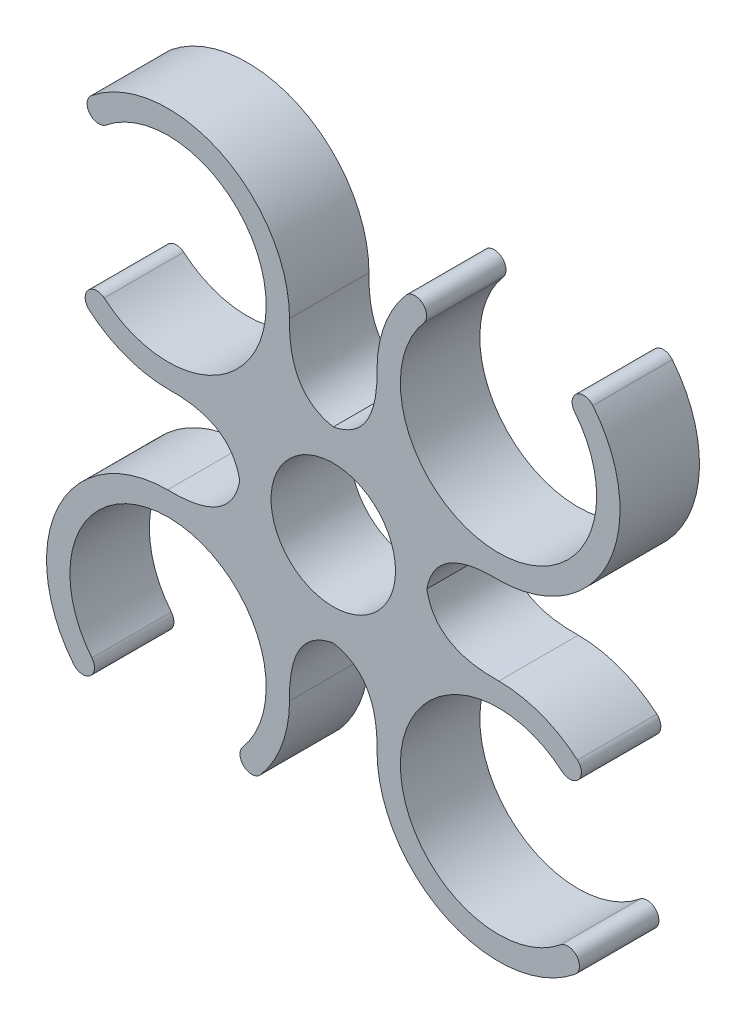
from build123d import *

# Parameters (mm, degrees)
ESQUISSE2_R        = 13.315895319
BOSS_EXTRU_1_DEPTH = 17


with BuildPart() as part:
    # Esquisse2 → Boss.-Extru.1 (new body)
    with BuildSketch(Plane.XY):
        with BuildLine():
            ThreePointArc((-41.970273906, 58.288916899), (-45.477336755, 58.674660716), (-45.106104784, 62.183289358))
            ThreePointArc((-45.106104784, 62.183289358), (-17.574909645, 65.492333679), (-2.716007813, 42.080167687))
            add(Edge.make_bspline(
                [(-2.716007813, 42.080167687), (-3.035124512, 28.491732954), (6.642053999, 26.657753906)],
                knots=[0, 0, 0, 1, 1, 1], degree=2))
            add(Edge.make_bspline(
                [(16, 42.080237959), (16.319218738, 28.491805623), (6.642053999, 26.657753906)],
                knots=[0, 0, 0, 1, 1, 1], degree=2))
            ThreePointArc((16, 42.080237959), (17.620066034, 51.034561919), (22.226418394, 58.882239885))
            ThreePointArc((22.226418394, 58.882239885), (25.715663474, 59.135975829), (26.044340034, 55.652990776))
            ThreePointArc((26.044340034, 55.652990776), (22.521938117, 34.151609621), (39.967073041, 21.098488371))
            ThreePointArc((39.967073041, 21.098488371), (60.505936251, 32.073055278), (58.288905312, 55.254314833))
            ThreePointArc((58.288905312, 55.254314833), (58.674649129, 58.761377683), (62.18327777, 58.390145711))
            ThreePointArc((62.18327777, 58.390145711), (65.492322092, 30.858950572), (42.080156099, 16.000048741))
            add(Edge.make_bspline(
                [(42.080156099, 16.000048741), (28.491721366, 16.319165439), (26.657742318, 6.641986928)],
                knots=[0, 0, 0, 1, 1, 1], degree=2))
            add(Edge.make_bspline(
                [(42.080226372, -2.715959073), (28.491794035, -3.035177811), (26.657742318, 6.641986928)],
                knots=[0, 0, 0, 1, 1, 1], degree=2))
            ThreePointArc((42.080226372, -2.715959073), (51.034550331, -4.336025106), (58.882228297, -8.942377467))
            ThreePointArc((58.882228297, -8.942377467), (59.135964241, -12.431622547), (55.652979189, -12.760299107))
            ThreePointArc((55.652979189, -12.760299107), (34.151598033, -9.23789719), (21.098476784, -26.683032113))
            ThreePointArc((21.098476784, -26.683032113), (32.07304369, -47.221895323), (55.254303246, -45.004864384))
            ThreePointArc((55.254303246, -45.004864384), (58.761366095, -45.390608201), (58.390134124, -48.899236843))
            ThreePointArc((58.390134124, -48.899236843), (30.858938985, -52.208281164), (16.000037153, -28.796115172))
            add(Edge.make_bspline(
                [(16.000037153, -28.796115172), (16.319153851, -15.207680439), (6.64197534, -13.373701391)],
                knots=[0, 0, 0, 1, 1, 1], degree=2))
            add(Edge.make_bspline(
                [(-2.71597066, -28.796185444), (-3.035189399, -15.207753108), (6.64197534, -13.373701391)],
                knots=[0, 0, 0, 1, 1, 1], degree=2))
            ThreePointArc((-2.71597066, -28.796185444), (-4.336036694, -37.750509404), (-8.942389054, -45.59818737))
            ThreePointArc((-8.942389054, -45.59818737), (-12.431634134, -45.851923314), (-12.760310694, -42.368938261))
            ThreePointArc((-12.760310694, -42.368938261), (-9.237908778, -20.867557106), (-26.683043701, -7.814435856))
            ThreePointArc((-26.683043701, -7.814435856), (-47.221906911, -18.789002763), (-45.004875972, -41.970262318))
            ThreePointArc((-45.004875972, -41.970262318), (-45.390619789, -45.477325168), (-48.899248431, -45.106093196))
            ThreePointArc((-48.899248431, -45.106093196), (-52.208292752, -17.574898057), (-28.79612676, -2.715996226))
            add(Edge.make_bspline(
                [(-28.79612676, -2.715996226), (-15.207692026, -3.035112924), (-13.373712979, 6.642065587)],
                knots=[0, 0, 0, 1, 1, 1], degree=2))
            add(Edge.make_bspline(
                [(-28.796197032, 16.000011588), (-15.207764695, 16.319230326), (-13.373712979, 6.642065587)],
                knots=[0, 0, 0, 1, 1, 1], degree=2))
            ThreePointArc((-28.796197032, 16.000011588), (-37.750520991, 17.620077621), (-45.598198957, 22.226429982))
            ThreePointArc((-45.598198957, 22.226429982), (-45.851934901, 25.715675062), (-42.368949849, 26.044351622))
            ThreePointArc((-42.368949849, 26.044351622), (-20.867568694, 22.521949705), (-7.814447444, 39.967084628))
            ThreePointArc((-7.814447444, 39.967084628), (-18.789014351, 60.505947838), (-41.970273906, 58.288916899))
        make_face()
        with Locations((6.64201467, 6.642026257)):
            Circle(ESQUISSE2_R, mode=Mode.SUBTRACT)
    extrude(amount=BOSS_EXTRU_1_DEPTH)


solid = part.part
